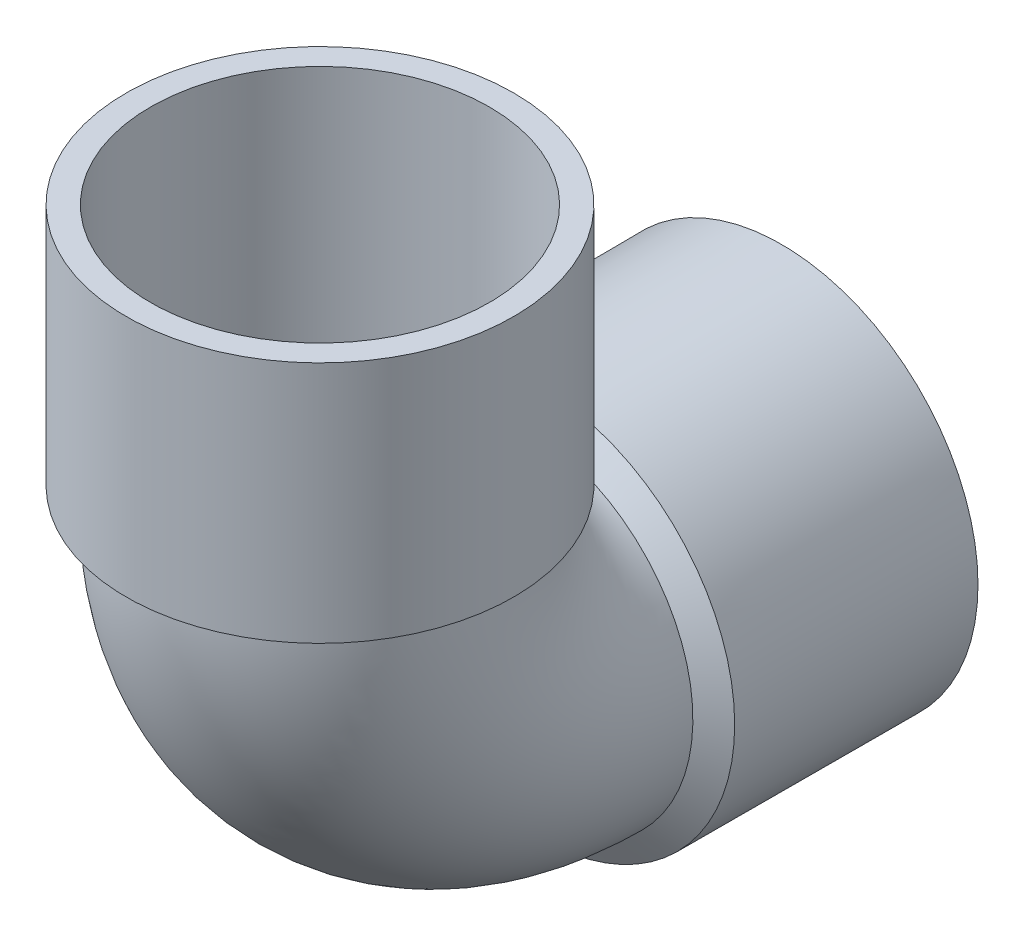
from build123d import *

# Parameters (mm, degrees)
SKETCH1_R      = 21.055
SKETCH1_R_2    = 18.055
REVOLVE1_ANGLE = 90
SKETCH14_W     = 3
SKETCH14_H     = 30
SCALE1_SCALE   = 0.760151086


with BuildPart() as part:
    # Sketch1 → Revolve1 (revolve)
    with BuildSketch(Plane(origin=(0, 0, 0), x_dir=(1, 0, 0), z_dir=(0, 1, 0))):
        Circle(SKETCH1_R)
        Circle(SKETCH1_R_2, mode=Mode.SUBTRACT)
    revolve(axis=Axis((-39.148672595, 0, -25), (1, 0, 0)), revolution_arc=REVOLVE1_ANGLE)

    # Sketch14 → Revolve3 (revolve)
    with BuildSketch(Plane(origin=(0, 0, 0), x_dir=(0, 0, -1), z_dir=(1, 0, 0)), mode=Mode.PRIVATE) as revolve3_sk:
        Polygon((-23.925834548, 2), (-20.925834548, 2), (-17.922072033, 0), (-20.922072033, 0), align=None)
        with Locations((-22.425834548, 17)):
            Rectangle(SKETCH14_W, SKETCH14_H)
    revolve(revolve3_sk.sketch.rotate(Axis((0, 0, 0), (0, 1, 0)), 180), axis=Axis((0, 0, 0), (0, 1, 0)))

    # Sketch20 → Revolve4 (revolve)
    with BuildSketch(Plane(origin=(0, 0, 0), x_dir=(0, 0, -1), z_dir=(1, 0, 0)), mode=Mode.PRIVATE) as revolve4_sk:
        Polygon((27, -49.217355789), (57, -49.26533892), (57, -46.26533892), (27, -46.217355789), align=None)
        Polygon((25, -46.055), (27, -49.217355789), (27, -46.217355789), (25, -43.055), align=None)
    revolve(revolve4_sk.sketch.rotate(Axis((0, -25, -25), (0, 0, -1)), 270), axis=Axis((0, -25, -25), (0, 0, -1)))


with BuildPart() as part_1:
    # Scale1: scaled about (0, -10.246924986, -14.93985455)
    add(part.part.scale(SCALE1_SCALE).moved(Location((0, -2.45771383, -3.583307889))))


solid = part_1.part
